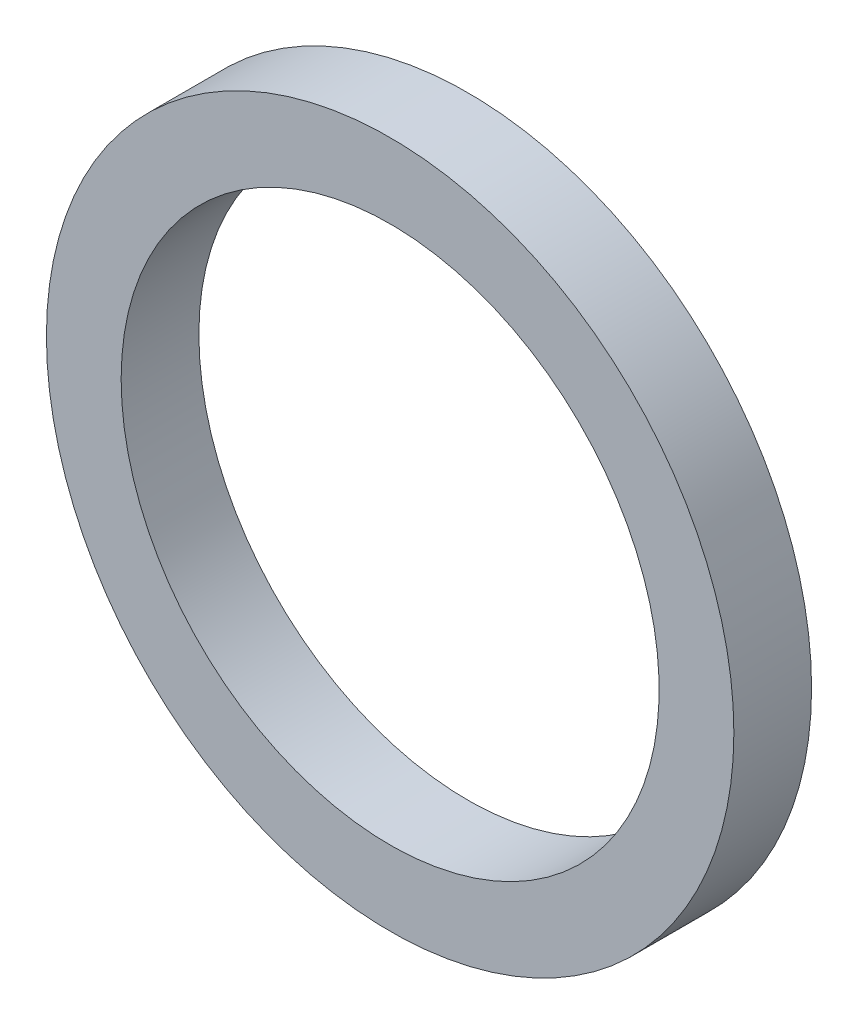
from build123d import *

# Parameters (mm, degrees)
SKETCH_1_R      = 57.5
SKETCH_1_R_2    = 45
EXTRUDE_1_DEPTH = 13


with BuildPart() as part:
    # 草图1 → 凸台-拉伸1 (new body)
    with BuildSketch(Plane.XY):
        with Locations(Location((0, 0, 0), (0, 0, 180))):
            Circle(SKETCH_1_R)
        with Locations(Location((0, 0, 0), (0, 0, 180))):
            Circle(SKETCH_1_R_2, mode=Mode.SUBTRACT)
    extrude(amount=EXTRUDE_1_DEPTH)


solid = part.part
